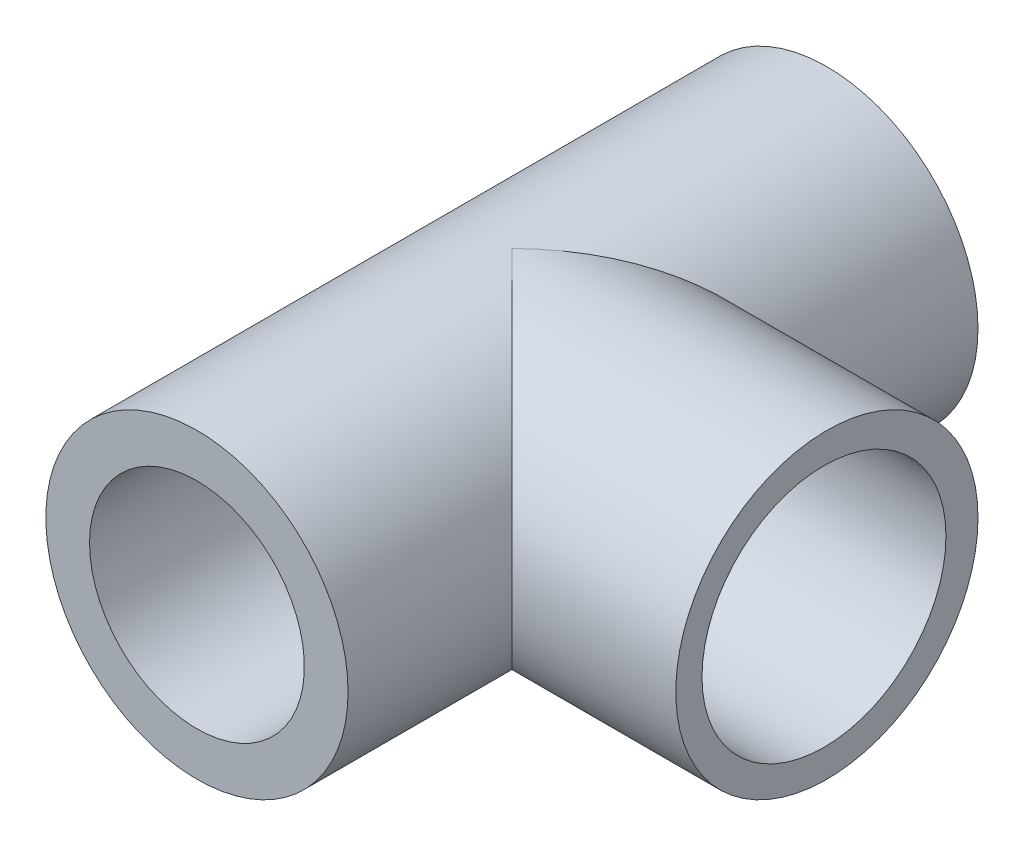
from build123d import *

# Parameters (mm, degrees)
SKETCH1_R           = 16.4703125
BOSS_EXTRUDE1_DEPTH = 68.659375
SKETCH2_R           = 16.4703125
BOSS_EXTRUDE2_DEPTH = 34.3296875
SKETCH3_R           = 11.7078125
CUT_EXTRUDE1_DEPTH  = 34.3296875
SKETCH4_R           = 13.2953125
CUT_EXTRUDE2_DEPTH  = 25.796875
SKETCH5_R           = 11.7078125
CUT_EXTRUDE3_DEPTH  = 79.51056243


with BuildPart() as part:
    # Sketch1 → Boss-Extrude1 (new body)
    with BuildSketch(Plane.XY):
        Circle(SKETCH1_R)
    extrude(amount=BOSS_EXTRUDE1_DEPTH)

    # Sketch2 → Boss-Extrude2 (add)
    with BuildSketch(Plane(origin=(0, 0, 0), x_dir=(0, 0, -1), z_dir=(1, 0, 0))):
        with Locations((-34.3296875, 0)):
            Circle(SKETCH2_R)
    extrude(amount=BOSS_EXTRUDE2_DEPTH)

    # Sketch3 → Cut-Extrude1 (cut)
    with BuildSketch(Plane(origin=(34.3296875, 0, 0), x_dir=(0, 0, -1), z_dir=(1, 0, 0))):
        with Locations((-34.3296875, 0)):
            Circle(SKETCH3_R)
    extrude(amount=-CUT_EXTRUDE1_DEPTH, mode=Mode.SUBTRACT)

    # Sketch4 → Cut-Extrude2 (cut)
    with BuildSketch(Plane(origin=(34.3296875, 0, 0), x_dir=(0, 0, -1), z_dir=(1, 0, 0))):
        with Locations((-34.647030574, 0)):
            Circle(SKETCH4_R)
    extrude(amount=-CUT_EXTRUDE2_DEPTH, mode=Mode.SUBTRACT)

    # Sketch5 → Cut-Extrude3 (cut, through all)
    with BuildSketch(Plane(origin=(0, 0, 0), x_dir=(-1, 0, 0), z_dir=(0, 0, -1))):
        Circle(SKETCH5_R)
    extrude(amount=-CUT_EXTRUDE3_DEPTH, mode=Mode.SUBTRACT)


solid = part.part
